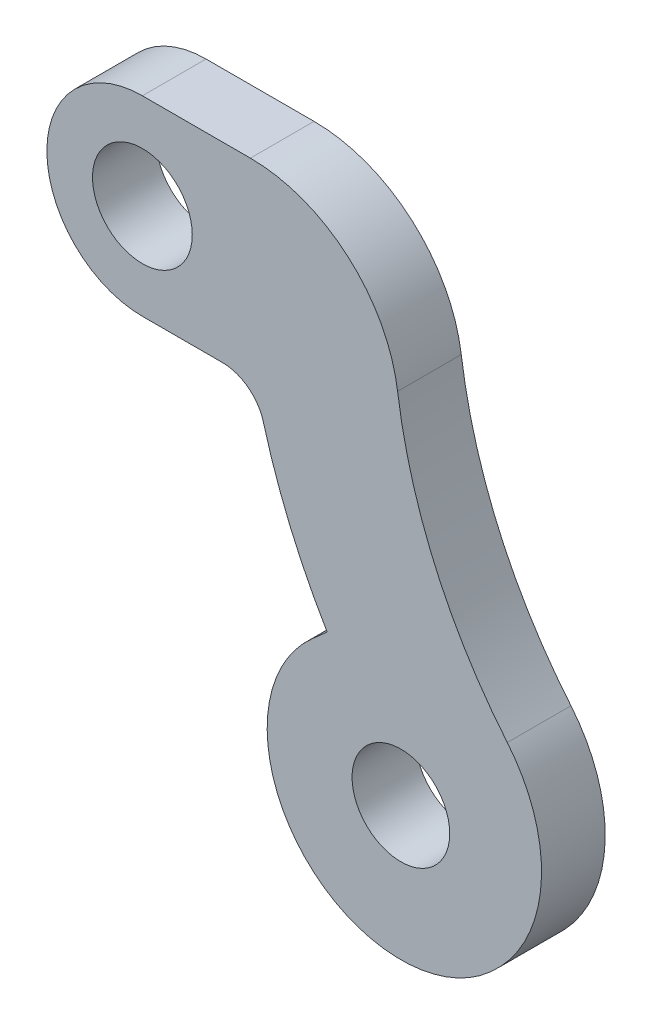
from build123d import *

# Parameters (mm, degrees)
SKETCH1_R           = 2.35
SKETCH1_R_2         = 2.3
BOSS_EXTRUDE2_DEPTH = 3


with BuildPart() as part:
    # Sketch1 → Boss-Extrude2 (new body)
    with BuildSketch(Plane.XY.offset(-130.24387898)):
        with BuildLine():
            Line((-15.010059364, 38.189351968), (-15.708117617, 37.572463316))
            ThreePointArc((-15.708117617, 37.572463316), (-16.257044738, 28.67984396), (-7.364425381, 28.130916839))
            Line((-7.364425381, 28.130916839), (-7.27434556, 28.210522262))
            ThreePointArc((-7.27434556, 28.210522262), (-4.930575043, 32.916016457), (-6.522896429, 37.925951432))
            ThreePointArc((-6.522896429, 37.925951432), (-9.929258204, 43.436995693), (-11.691880866, 49.671421949))
            ThreePointArc((-11.691880866, 49.671421949), (-14.02608552, 53.994717475), (-18.626779298, 55.718960016))
            Line((-18.626779298, 55.718960016), (-23.716053845, 55.718960016))
            ThreePointArc((-23.716053845, 55.718960016), (-28.216053845, 51.218960016), (-23.716053845, 46.718960016))
            Line((-23.716053845, 46.718960016), (-19.942226175, 46.718960016))
            ThreePointArc((-19.942226175, 46.718960016), (-18.729620599, 46.309427783), (-18.013616093, 45.248547734))
            ThreePointArc((-18.013616093, 45.248547734), (-16.74918621, 41.617962479), (-15.010059364, 38.189351968))
        make_face()
        with Locations((-23.716053845, 51.218960016)):
            Circle(SKETCH1_R, mode=Mode.SUBTRACT)
        with Locations((-11.536271499, 32.851690078)):
            Circle(SKETCH1_R_2, mode=Mode.SUBTRACT)
    extrude(amount=BOSS_EXTRUDE2_DEPTH)


solid = part.part
